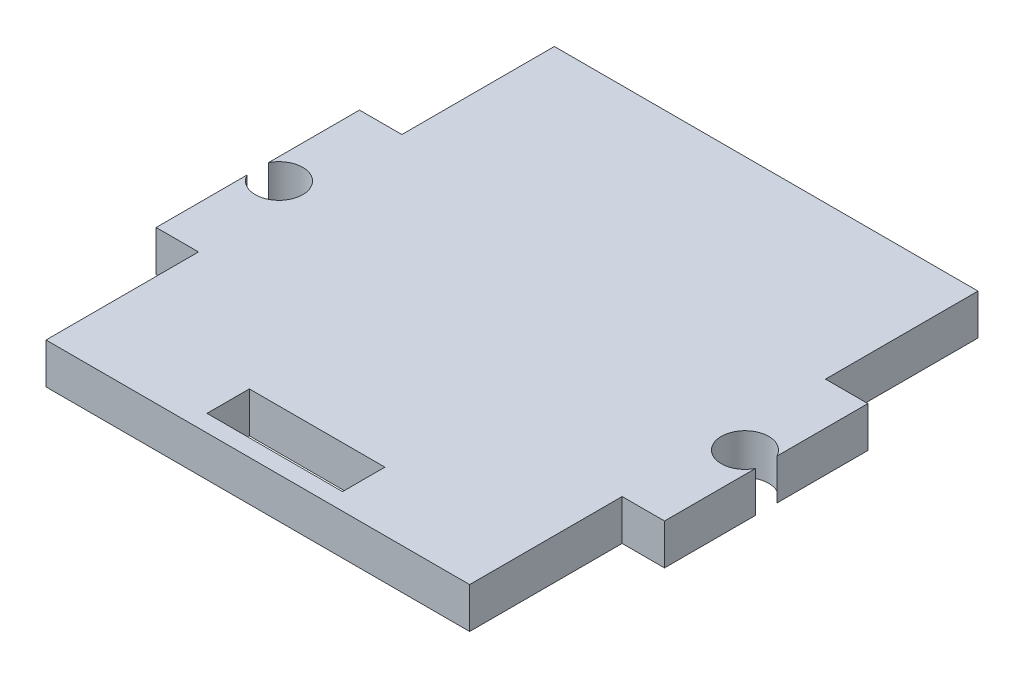
from build123d import *

# Parameters (mm, degrees)
BOSS_EXTRUDE1_DEPTH = 3.048
SKETCH2_W           = 10.16
SKETCH2_H           = 3.175
CUT_EXTRUDE1_DEPTH  = 54.967678327


with BuildPart() as part:
    # Sketch1 → Boss-Extrude1 (new body)
    with BuildSketch(Plane(origin=(0, 0, 0), x_dir=(1, 0, 0), z_dir=(0, 1, 0))):
        with BuildLine():
            Line((3.175, 38.1), (3.175, 26.67))
            Line((3.175, 26.67), (0, 26.67))
            Line((0, 26.67), (0, 19.850704534))
            ThreePointArc((0, 19.850704534), (3.3655, 19.05), (0, 18.249295466))
            Line((0, 18.249295466), (0, 11.43))
            Line((0, 11.43), (3.175, 11.43))
            Line((3.175, 11.43), (3.175, 0))
            Line((3.175, 0), (34.925, 0))
            Line((34.925, 0), (34.925, 11.43))
            Line((34.925, 11.43), (38.1, 11.43))
            Line((38.1, 11.43), (38.1, 18.249295466))
            ThreePointArc((38.1, 18.249295466), (34.7345, 19.05), (38.1, 19.850704534))
            Line((38.1, 19.850704534), (38.1, 26.67))
            Line((38.1, 26.67), (34.925, 26.67))
            Line((34.925, 26.67), (34.925, 38.1))
            Line((34.925, 38.1), (3.175, 38.1))
        make_face()
    extrude(amount=BOSS_EXTRUDE1_DEPTH)

    # Sketch2 → Cut-Extrude1 (cut, through all)
    with BuildSketch(Plane(origin=(0, 3.048, 0), x_dir=(1, 0, 0), z_dir=(0, 1, 0))):
        with Locations((19.05, 2.8575)):
            Rectangle(SKETCH2_W, SKETCH2_H)
    extrude(amount=-CUT_EXTRUDE1_DEPTH, mode=Mode.SUBTRACT)


solid = part.part
